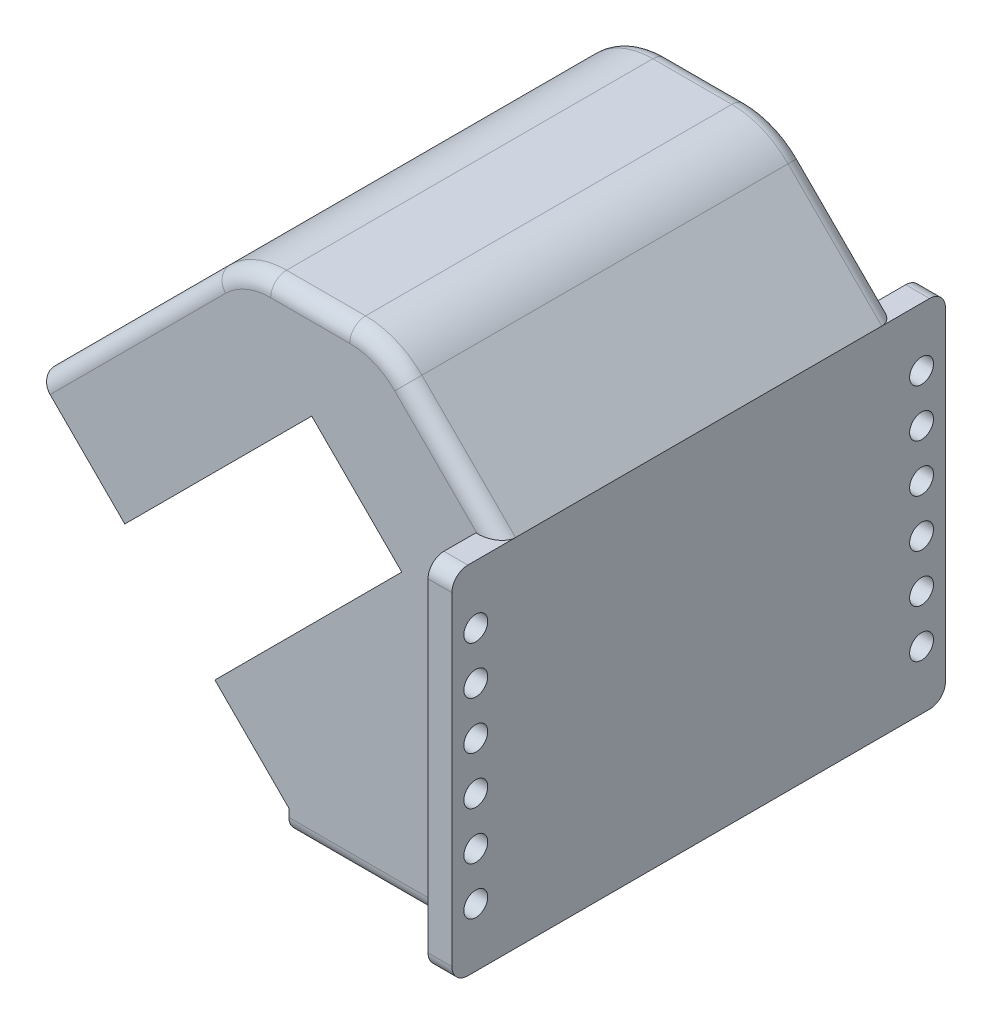
from build123d import *

# Parameters (mm, degrees)
EXTRUDE_1_DEPTH     = 50
EXTRUDE_3_DEPTH     = 33.199998
EXTRUDE_4_REACH     = 79.048
SKETCH_4_W          = 50
SKETCH_4_H          = 2.121320344
CUT_EXTRUDE_1_DEPTH = 99.405896905
SKETCH_8_W          = 62
SKETCH_8_H          = 44.689148571
SKETCH_8_R          = 1.5
EXTRUDE_5_DEPTH     = 3
FILLET_1_R          = 10
FILLET_2_R          = 2


with BuildPart() as part:
    # 草图1 → 凸台-拉伸1 (new body)
    with BuildSketch(Plane.XY):
        Polygon((25.716046069, 61.209761814), (43.929249505, 61.209761814), (58.626662914, 46.512348406), (58.626662914, 1.823199835), (32.150717778, 1.823199835), (32.150717778, 4.823199835), (55.626662914, 28.29914497), (25.716046069, 58.209761814), align=None)
    extrude(amount=EXTRUDE_1_DEPTH)

    # 草图3 → 凸台-拉伸3 (add)
    with BuildSketch(Plane(origin=(41.962903942, 41.962903942, 0), x_dir=(0, 0, 1), z_dir=(-0.7071067811865476, -0.7071067811865476, 0))):
        Polygon((50, -19.323473251), (46.15, -19.323473251), (43.15, -19.323473251), (46.15, -16.323473251), (46.15, 19.976526749), (43.15, 22.976526749), (46.15, 22.976526749), (50, 22.976526749), align=None)
        Polygon((0, 22.976526749), (0, -19.323473251), (3.85, -19.323473251), (6.85, -19.323473251), (3.85, -16.323473251), (3.85, 19.976526749), (6.85, 22.976526749), (3.85, 22.976526749), align=None)
    extrude(amount=EXTRUDE_3_DEPTH)

    # 凸台-拉伸4: up to this plane
    extrude_4_end = Plane(origin=(25.716046069, 61.209761814, 50), z_dir=(0, -1, 0))
    # 草图4 → 凸台-拉伸4 (add, up to the surface)
    with BuildSketch(Plane(origin=(18.486958806, 18.486958806, 0), x_dir=(0, 0, 1), z_dir=(-0.7071067811865477, -0.7071067811865475, 0)), mode=Mode.PRIVATE) as extrude_4_sk1:
        with Locations((25, 24.037186921)):
            Rectangle(SKETCH_4_W, SKETCH_4_H)
    extrude_4_tool1 = split(extrude(extrude_4_sk1.sketch, amount=-EXTRUDE_4_REACH, mode=Mode.PRIVATE), bisect_by=extrude_4_end, keep=Keep.BOTH, mode=Mode.PRIVATE)
    add(extrude_4_tool1.solids().sort_by_distance((1.490101, 35.483817, 25))[0])

    # 草图5 → 切除-拉伸1 (cut, through all)
    with BuildSketch(Plane(origin=(0, 0, 0), x_dir=(-1, 0, 0), z_dir=(0, 0, -1))):
        Polygon((-35.014500242, 48.911307642), (-46.328208741, 37.597599143), (-22.852263606, 14.121654007), (-11.538555107, 25.435362506), align=None)
    extrude(amount=-CUT_EXTRUDE_1_DEPTH, mode=Mode.SUBTRACT)

    # 草图8 → 凸台-拉伸5 (add)
    with BuildSketch(Plane(origin=(58.626662914, 0, 0), x_dir=(0, 0, -1), z_dir=(1, 0, 0))):
        with Locations((-25, 24.16777412)):
            Rectangle(SKETCH_8_W, SKETCH_8_H)
        with Locations(Location((-53, 39.162348406, 0), (0, 0, 90))):
            Circle(SKETCH_8_R, mode=Mode.SUBTRACT)
        with Locations(Location((-53, 33.162348406, 0), (0, 0, 90))):
            Circle(SKETCH_8_R, mode=Mode.SUBTRACT)
        with Locations(Location((-53, 27.162348406, 0), (0, 0, 90))):
            Circle(SKETCH_8_R, mode=Mode.SUBTRACT)
        with Locations(Location((-53, 21.162348406, 0), (0, 0, 90))):
            Circle(SKETCH_8_R, mode=Mode.SUBTRACT)
        with Locations(Location((-53, 15.162348406, 0), (0, 0, 90))):
            Circle(SKETCH_8_R, mode=Mode.SUBTRACT)
        with Locations(Location((-53, 9.162348406, 0), (0, 0, 90))):
            Circle(SKETCH_8_R, mode=Mode.SUBTRACT)
        with Locations(Location((3, 9.162348406, 0), (0, 0, 270))):
            Circle(SKETCH_8_R, mode=Mode.SUBTRACT)
        with Locations(Location((3, 15.162348406, 0), (0, 0, 270))):
            Circle(SKETCH_8_R, mode=Mode.SUBTRACT)
        with Locations(Location((3, 21.162348406, 0), (0, 0, 270))):
            Circle(SKETCH_8_R, mode=Mode.SUBTRACT)
        with Locations(Location((3, 27.162348406, 0), (0, 0, 270))):
            Circle(SKETCH_8_R, mode=Mode.SUBTRACT)
        with Locations(Location((3, 33.162348406, 0), (0, 0, 270))):
            Circle(SKETCH_8_R, mode=Mode.SUBTRACT)
        with Locations(Location((3, 39.162348406, 0), (0, 0, 270))):
            Circle(SKETCH_8_R, mode=Mode.SUBTRACT)
    extrude(amount=-EXTRUDE_5_DEPTH)

    # 圆角1
    fillet_1_edges = [part.edges().sort_by_distance(p)[0] for p in [
        (25.716046069, 61.209761814, 25),
        (43.929249505, 61.209761814, 25),
    ]]
    fillet(fillet_1_edges, radius=FILLET_1_R)

    # 圆角2
    fillet_2_edges = [part.edges().sort_by_distance(p)[0] for p in [
        (52.742422303, 52.396589016, 0),
        (57.126662914, 1.823199835, -6),
        (57.126662914, 1.823199835, 56),
        (57.126662914, 46.512348406, 56),
        (57.126662914, 46.512348406, -6),
        (34.822647787, 61.209761814, 0),
        (34.822647787, 61.209761814, 50),
        (11.763607408, 47.257323152, 0),
        (26.031347369, 60.448557139, 0),
        (43.613948205, 60.448557139, 0),
        (11.763607408, 47.257323152, 50),
        (26.031347369, 60.448557139, 50),
        (43.613948205, 60.448557139, 50),
        (43.888690346, 1.823199835, 50),
        (43.888690346, 1.823199835, 0),
        (52.742422303, 52.396589016, 50),
    ]]
    fillet(fillet_2_edges, radius=FILLET_2_R)


solid = part.part
